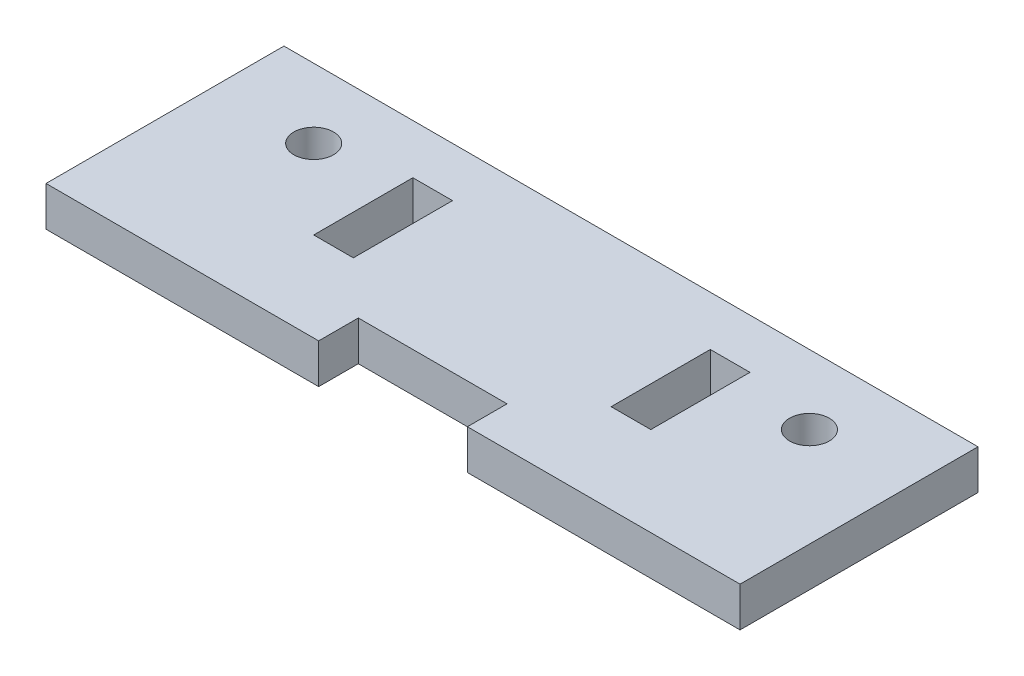
from build123d import *

# Parameters (mm, degrees)
SKETCH1_R           = 2
SKETCH1_W           = 4
SKETCH1_H           = 10
BOSS_EXTRUDE1_DEPTH = 4


with BuildPart() as part:
    # Sketch1 → Boss-Extrude1 (new body)
    with BuildSketch(Plane(origin=(0, 0, 0), x_dir=(1, 0, 0), z_dir=(0, 1, 0))):
        Polygon((0, 0), (20, 0), (27.5, 0), (27.5, 4), (42.5, 4), (42.5, 0), (50, 0), (70, 0), (70, 24), (0, 24), align=None)
        with Locations(Location((10, 17, 0), (0, 0, 270))):
            Circle(SKETCH1_R, mode=Mode.SUBTRACT)
        with Locations(Location((60, 17, 0), (0, 0, 90))):
            Circle(SKETCH1_R, mode=Mode.SUBTRACT)
        with Locations((20, 14)):
            Rectangle(SKETCH1_W, SKETCH1_H, mode=Mode.SUBTRACT)
        with Locations((50, 14)):
            Rectangle(SKETCH1_W, SKETCH1_H, mode=Mode.SUBTRACT)
    extrude(amount=BOSS_EXTRUDE1_DEPTH)


solid = part.part
